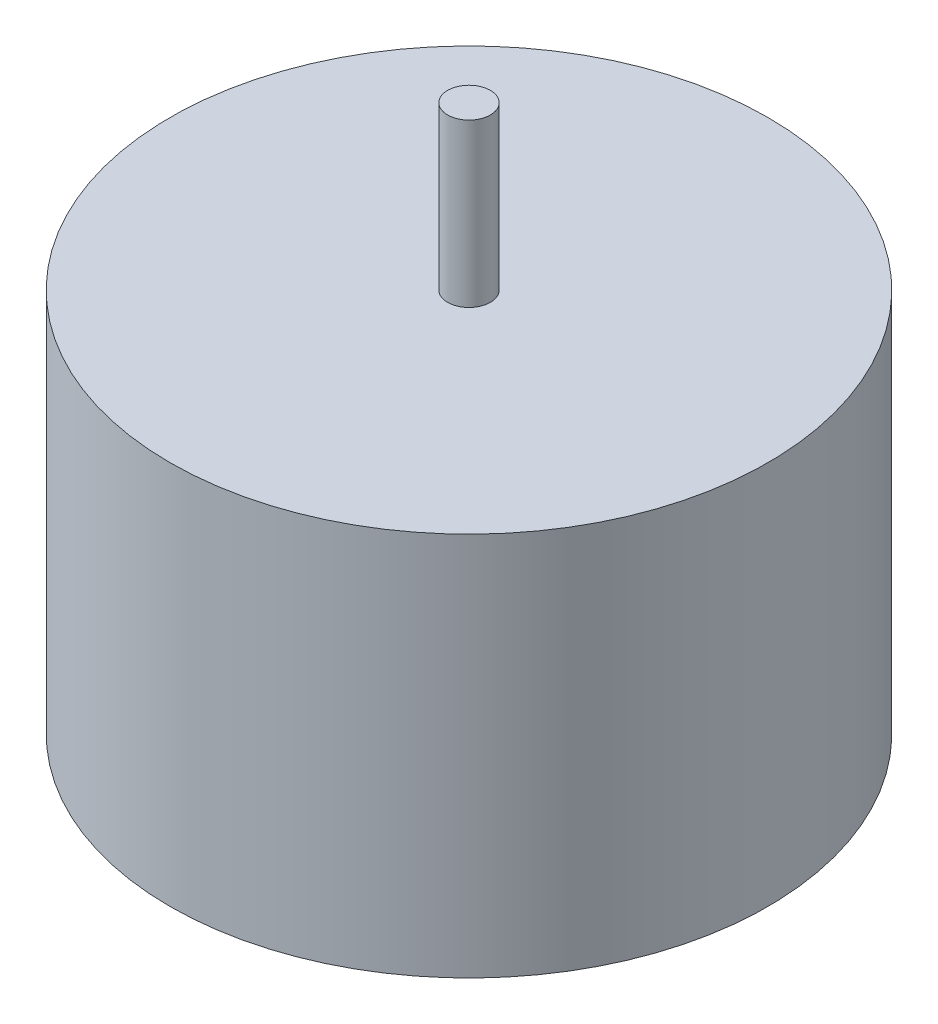
from build123d import *

# Parameters (mm, degrees)
SKETCH_1_R          = 7
EXTRUDE_1_DEPTH     = 9
SKETCH_2_R          = 1
CUT_EXTRUDE_2_DEPTH = 2.5
SKETCH_3_R          = 0.5
EXTRUDE_2_DEPTH     = 3.8


with BuildPart() as part:
    # 草图1 → 凸台-拉伸1 (new body)
    with BuildSketch(Plane(origin=(0, 0, 0), x_dir=(1, 0, 0), z_dir=(0, 1, 0))):
        with Locations(Location((0, 0, 0), (0, 0, 270))):
            Circle(SKETCH_1_R)
    extrude(amount=EXTRUDE_1_DEPTH)

    # 草图2 → 切除-拉伸2 (cut)
    with BuildSketch(Plane.XZ):
        with Locations(Location((0, 4.5, 0), (0, 0, 270))):
            Circle(SKETCH_2_R)
        with Locations(Location((0, -4.5, 0), (0, 0, 270))):
            Circle(SKETCH_2_R)
        with Locations(Location((4.5, 0, 0), (0, 0, 270))):
            Circle(SKETCH_2_R)
        with Locations(Location((-4.5, 0, 0), (0, 0, 90))):
            Circle(SKETCH_2_R)
    extrude(amount=-CUT_EXTRUDE_2_DEPTH, mode=Mode.SUBTRACT)

    # 草图3 → 凸台-拉伸2 (add)
    with BuildSketch(Plane(origin=(0, 9, 0), x_dir=(1, 0, 0), z_dir=(0, 1, 0))):
        with Locations(Location((0, 0, 0), (0, 0, 270))):
            Circle(SKETCH_3_R)
    extrude(amount=EXTRUDE_2_DEPTH)


solid = part.part
